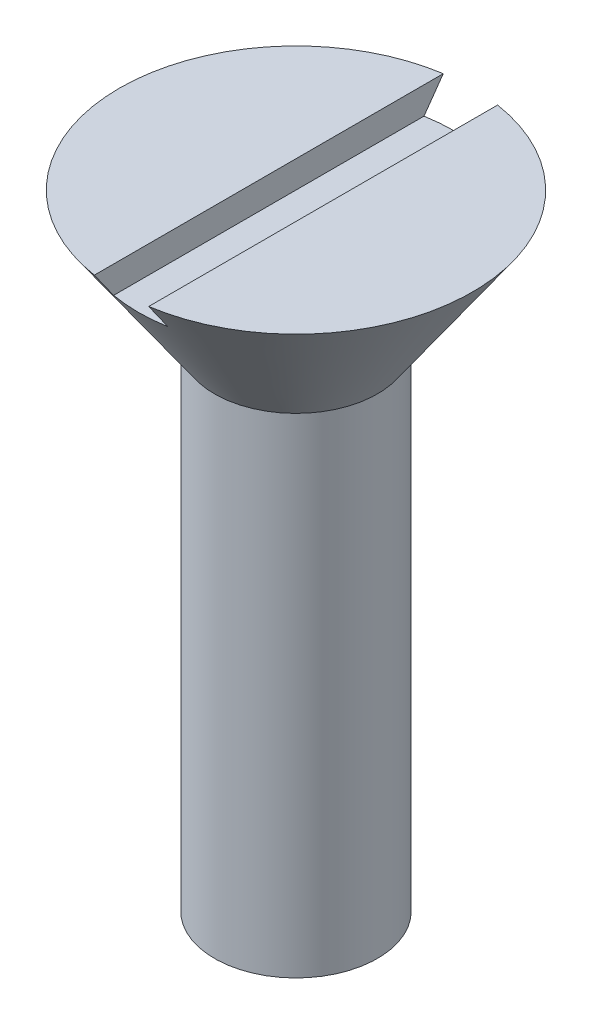
from build123d import *

# Parameters (mm, degrees)
CUT_EXTRUDE2_DEPTH = 1


with BuildPart() as part:
    # Sketch2 → Revolve1 (revolve)
    with BuildSketch(Plane.XY, mode=Mode.PRIVATE) as revolve1_sk:
        Polygon((0, -16.412300512), (0, -18.14435132), (3, -16.412300512), (3, 1.587699488), (6.5, 6.587699488), (0, 6.587699488), align=None)
    revolve(revolve1_sk.sketch.rotate(Axis((0, 6.587699488, 0), (0, -1, 0)), 180), axis=Axis((0, 6.587699488, 0), (0, -1, 0)))

    # Sketch4 → Cut-Extrude2 (cut)
    with BuildSketch(Plane(origin=(0, 6.587699488, 0), x_dir=(1, 0, 0), z_dir=(0, 1, 0))):
        Polygon((-1, 6.422616289), (-1, -6.422616289), (-1, -6.622896644), (1, -6.622896644), (1, -6.422616289), (1, 6.422616289), (1, 6.986214166), (-1, 6.986214166), align=None)
    extrude(amount=-CUT_EXTRUDE2_DEPTH, mode=Mode.SUBTRACT)


solid = part.part
